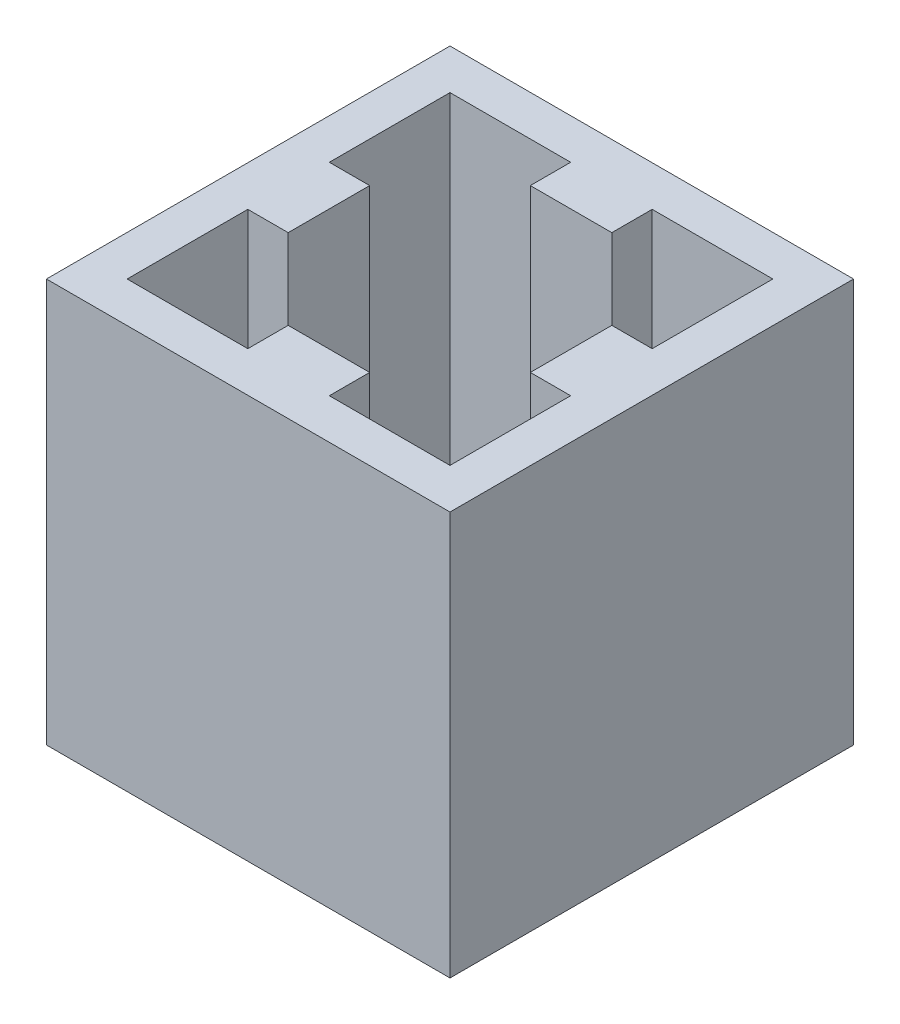
from build123d import *

# Parameters (mm, degrees)
SKETCH1_W           = 25.4
SKETCH1_H           = 25.4
BOSS_EXTRUDE1_DEPTH = 25.4
CUT_EXTRUDE2_DEPTH  = 22.86


with BuildPart() as part:
    # Sketch1 → Boss-Extrude1 (new body)
    with BuildSketch(Plane(origin=(0, 0, 0), x_dir=(1, 0, 0), z_dir=(0, 1, 0))):
        Rectangle(SKETCH1_W, SKETCH1_H)
    extrude(amount=BOSS_EXTRUDE1_DEPTH)

    # Sketch3 → Cut-Extrude2 (cut)
    with BuildSketch(Plane(origin=(0, 25.4, 0), x_dir=(1, 0, 0), z_dir=(0, 1, 0))):
        Polygon((10.16, 2.565122784), (7.62, 2.565122784), (7.62, -2.565122784), (10.16, -2.565122784), (10.16, -10.16), (2.565122784, -10.16), (2.565122784, -7.62), (-2.565122784, -7.62), (-2.565122784, -10.16), (-10.16, -10.16), (-10.16, -2.565122784), (-7.62, -2.565122784), (-7.62, 2.565122784), (-10.16, 2.565122784), (-10.16, 10.16), (-2.565122784, 10.16), (-2.565122784, 7.62), (2.565122784, 7.62), (2.565122784, 10.16), (10.16, 10.16), align=None)
    extrude(amount=-CUT_EXTRUDE2_DEPTH, mode=Mode.SUBTRACT)


solid = part.part
